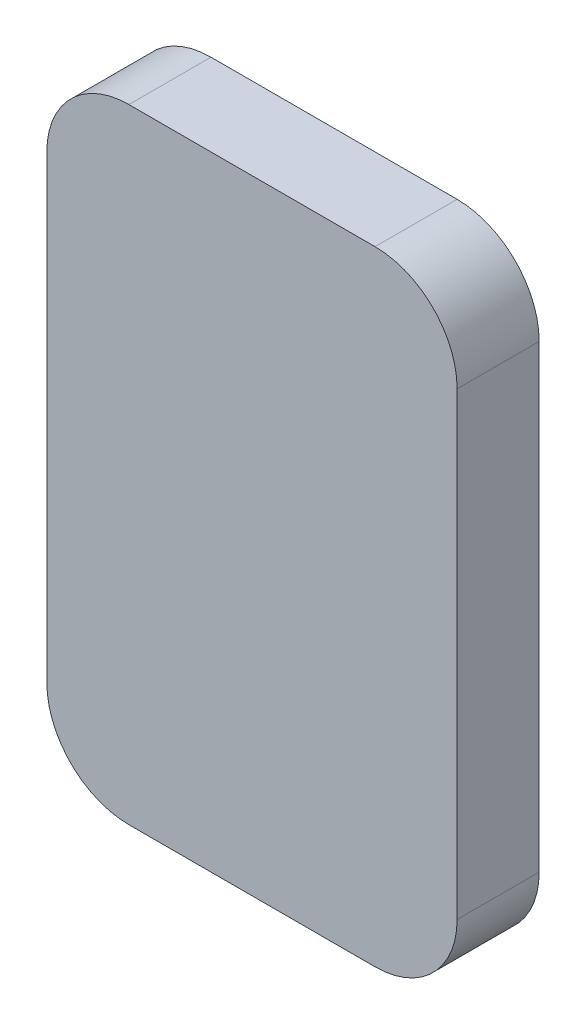
from build123d import *

# Parameters (mm, degrees)
SKETCH1_W           = 10
SKETCH1_H           = 15.2
BOSS_EXTRUDE1_DEPTH = 1
SKETCH1_8_W         = 10
SKETCH1_8_H         = 15.2
SKETCH1_8_W_2       = 8.44
SKETCH1_8_H_2       = 13.64
BOSS_EXTRUDE2_DEPTH = 1
SKETCH1_9_RX        = 6.016925947
SKETCH1_9_RY        = 3.157568793
BOSS_EXTRUDE3_DEPTH = 0.5
FILLET1_R           = 2


with BuildPart() as part:
    # Sketch1 (on Front Plane) → Boss-Extrude1 (new body)
    with BuildSketch(Plane.XY):
        with Locations((5, 7.6)):
            Rectangle(SKETCH1_W, SKETCH1_H)
    extrude(amount=BOSS_EXTRUDE1_DEPTH)

    # Sketch1<8> (on Front Plane) → Boss-Extrude2 (add)
    with BuildSketch(Plane.XY):
        with Locations((5, 7.6)):
            Rectangle(SKETCH1_8_W, SKETCH1_8_H)
        with Locations((5, 7.6)):
            Rectangle(SKETCH1_8_W_2, SKETCH1_8_H_2, mode=Mode.SUBTRACT)
    extrude(amount=-BOSS_EXTRUDE2_DEPTH)

    # Sketch1<9> (on Front Plane) → Boss-Extrude3 (add)
    # profile 1 of 3: a face of its own
    with BuildSketch(Plane.XY):
        with Locations(Location((5, 7.6), (0, 0, -120.316314342))):
            Ellipse(SKETCH1_9_RX, SKETCH1_9_RY)
        with BuildLine():
            Line((5.55192436, 7.939742657), (5.714255538, 7.749614835))
            ThreePointArc((5.714255538, 7.749614835), (5.903370184, 7.16725844), (5.625306277, 6.621746036))
            Line((5.625306277, 6.621746036), (4.673505596, 5.809098397))
            Line((4.673505596, 5.809098397), (5.102260043, 5.306926538))
            Line((5.102260043, 5.306926538), (3.276812461, 5.306926538))
            Line((3.276812461, 5.306926538), (3.562960201, 7.109807107))
            Line((3.562960201, 7.109807107), (3.991714649, 6.607635249))
            Line((3.991714649, 6.607635249), (5.55192436, 7.939742657))
        make_face(mode=Mode.SUBTRACT)
        with BuildLine():
            Line((4.44807564, 7.260257343), (4.285744462, 7.450385165))
            ThreePointArc((4.285744462, 7.450385165), (4.096629816, 8.03274156), (4.374693723, 8.578253964))
            Line((4.374693723, 8.578253964), (5.326494404, 9.390901603))
            Line((5.326494404, 9.390901603), (4.897739957, 9.893073462))
            Line((4.897739957, 9.893073462), (6.723187539, 9.893073462))
            Line((6.723187539, 9.893073462), (6.437039799, 8.090192893))
            Line((6.437039799, 8.090192893), (6.008285351, 8.592364751))
            Line((6.008285351, 8.592364751), (4.44807564, 7.260257343))
        make_face(mode=Mode.SUBTRACT)
    # profile 2 of 3: a face of its own
    with BuildSketch(Plane.XY):
        with BuildLine():
            add(Edge.make_bspline(
                [(9.22, 11.980450807), (5, 22.611600433), (0.78, 6.751239794)],
                knots=[2.731060957, 2.731060957, 2.731060957, 5.172488647, 5.172488647, 5.172488647], degree=2, weights=[1, 0.342975287, 1]))
            Line((9.22, 11.980450807), (9.22, 14.42))
            Line((9.22, 14.42), (0.78, 14.42))
            Line((0.78, 14.42), (0.78, 6.751239794))
        make_face()
        with BuildLine():
            Line((1.807963278, 12.267050426), (2.573541086, 12.912762773))
            Line((2.573541086, 12.912762773), (2.629548837, 12.846358141))
            ThreePointArc((2.629548837, 12.846358141), (2.72234926, 12.554615255), (2.581675695, 12.282702073))
            Line((2.581675695, 12.282702073), (2.125075804, 11.897591397))
            Line((2.125075804, 11.897591397), (2.341285421, 11.641246159))
            Line((2.341285421, 11.641246159), (1.436292724, 11.641246159))
            Line((1.436292724, 11.641246159), (1.578739925, 12.538825176))
            Line((1.578739925, 12.538825176), (1.807963278, 12.267050426))
        make_face(mode=Mode.SUBTRACT)
        with BuildLine():
            Line((2.79925212, 13.230809928), (2.013248175, 12.570380578))
            Line((2.013248175, 12.570380578), (1.941775235, 12.655443444))
            ThreePointArc((1.941775235, 12.655443444), (1.849520441, 12.947359327), (1.99070215, 13.219009018))
            Line((1.99070215, 13.219009018), (2.47045985, 13.622119038))
            Line((2.47045985, 13.622119038), (2.272289715, 13.857969409))
            Line((2.272289715, 13.857969409), (3.166035288, 13.857969409))
            Line((3.166035288, 13.857969409), (3.036644718, 12.948279301))
            Line((3.036644718, 12.948279301), (2.79925212, 13.230809928))
        make_face(mode=Mode.SUBTRACT)
    # profile 3 of 3: a face of its own
    with BuildSketch(Plane.XY):
        with BuildLine():
            Line((0.78, 0.78), (9.22, 0.78))
            Line((9.22, 0.78), (9.22, 8.448760206))
            add(Edge.make_bspline(
                [(1.745579435, 2.034365319), (6.736770522, -0.884158057), (9.22, 8.448760206)],
                knots=[0, 0, 0, 2.030895994, 2.030895994, 2.030895994], degree=2, weights=[1, 0.527239314, 1]))
            add(Edge.make_bspline(
                [(0.78, 3.219549193), (1.100794809, 2.411393361), (1.745579435, 2.034365319)],
                knots=[5.872653611, 5.872653611, 5.872653611, 6.283185307, 6.283185307, 6.283185307], degree=2, weights=[1, 0.979006832, 1]))
            Line((0.78, 3.219549193), (0.78, 0.78))
        make_face()
        with BuildLine():
            Line((7.056197058, 2.135669885), (7.291696407, 1.863373763))
            Line((7.291696407, 1.863373763), (8.063431346, 2.521185925))
            Line((8.063431346, 2.521185925), (8.112322941, 2.464655019))
            ThreePointArc((8.112322941, 2.464655019), (8.208731591, 2.174084541), (8.071438446, 1.900448977))
            Line((8.071438446, 1.900448977), (7.601212367, 1.493766963))
            Line((7.601212367, 1.493766963), (7.828929297, 1.230469263))
            Line((7.828929297, 1.230469263), (6.912689643, 1.230469263))
            Line((6.912689643, 1.230469263), (7.056197058, 2.135669885))
        make_face(mode=Mode.SUBTRACT)
        with BuildLine():
            Line((8.277665846, 2.828924058), (7.517372897, 2.16210975))
            Line((7.517372897, 2.16210975), (7.461453822, 2.225867947))
            ThreePointArc((7.461453822, 2.225867947), (7.36303426, 2.515763479), (7.498428218, 2.790343716))
            Line((7.498428218, 2.790343716), (7.969285134, 3.203308389))
            Line((7.969285134, 3.203308389), (7.7510695, 3.452115))
            Line((7.7510695, 3.452115), (8.654696366, 3.452115))
            Line((8.654696366, 3.452115), (8.51075838, 2.563155))
            Line((8.51075838, 2.563155), (8.277665846, 2.828924058))
        make_face(mode=Mode.SUBTRACT)
    extrude(amount=-BOSS_EXTRUDE3_DEPTH)

    # Fillet1
    fillet1_edges = [part.edges().sort_by_distance(p)[0] for p in [
        (0.78, 0.78, -0.75),
        (0.78, 14.42, -0.75),
        (9.22, 14.42, -0.75),
        (9.22, 0.78, -0.75),
        (0, 15.2, 0),
        (0, 0, 0),
        (10, 0, 0),
        (10, 15.2, 0),
    ]]
    fillet(fillet1_edges, radius=FILLET1_R)


solid = part.part
